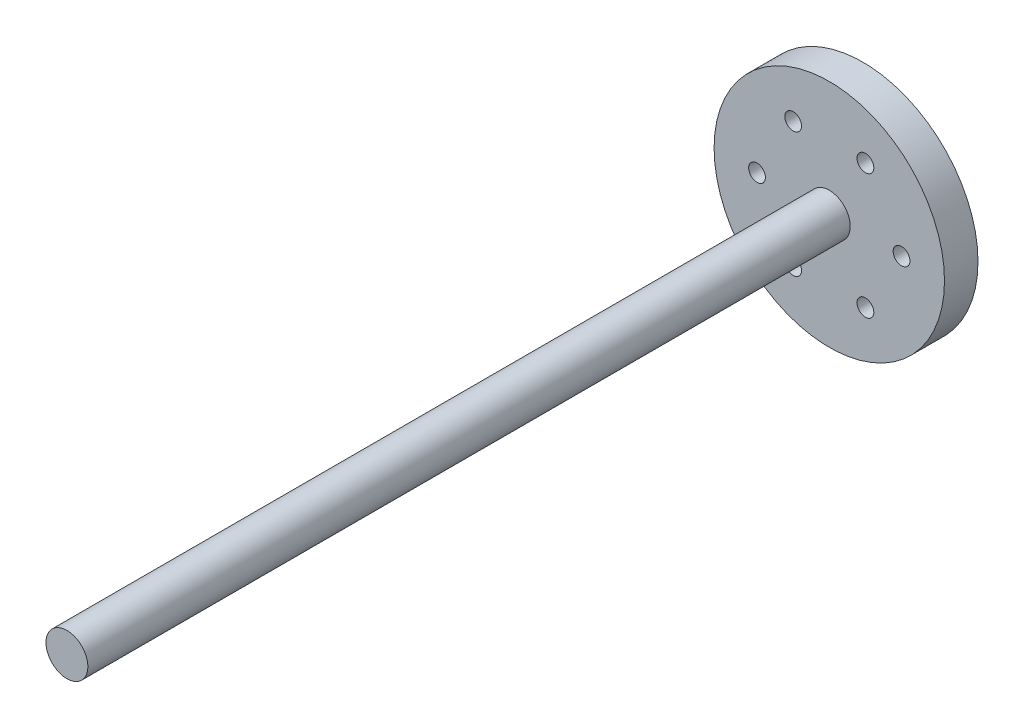
from build123d import *

# Parameters (mm, degrees)
SKETCH_1_R      = 27.5
SKETCH_1_R_2    = 2
EXTRUDE_1_DEPTH = 8
SKETCH_2_R      = 5
EXTRUDE_2_DEPTH = 182


with BuildPart() as part:
    # 草图1 → 凸台-拉伸1 (new body)
    with BuildSketch(Plane.XY):
        Circle(SKETCH_1_R)
        with Locations((-17.25, 0)):
            Circle(SKETCH_1_R_2, mode=Mode.SUBTRACT)
        with Locations((-8.625, 14.938938215)):
            Circle(SKETCH_1_R_2, mode=Mode.SUBTRACT)
        with Locations((8.625, 14.938938215)):
            Circle(SKETCH_1_R_2, mode=Mode.SUBTRACT)
        with Locations((17.25, 0)):
            Circle(SKETCH_1_R_2, mode=Mode.SUBTRACT)
        with Locations((8.625, -14.938938215)):
            Circle(SKETCH_1_R_2, mode=Mode.SUBTRACT)
        with Locations((-8.625, -14.938938215)):
            Circle(SKETCH_1_R_2, mode=Mode.SUBTRACT)
    extrude(amount=EXTRUDE_1_DEPTH)

    # 草图2 → 凸台-拉伸2 (add)
    with BuildSketch(Plane.XY.offset(8)):
        Circle(SKETCH_2_R)
    extrude(amount=EXTRUDE_2_DEPTH)


solid = part.part
